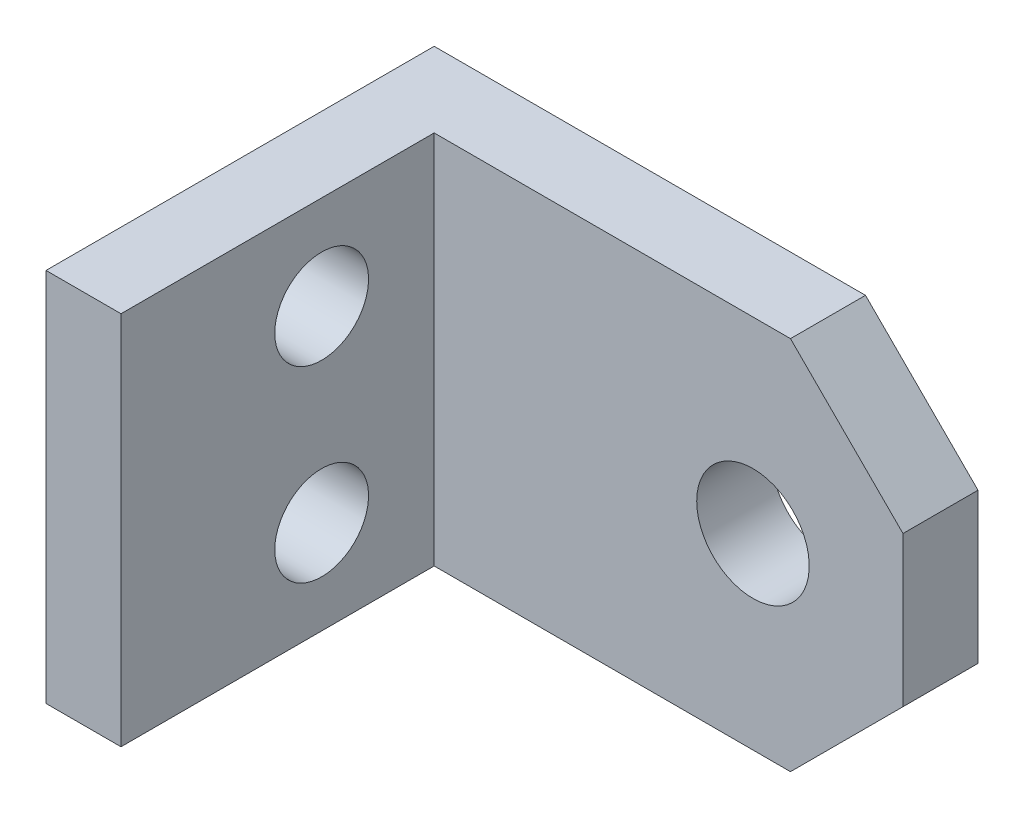
from build123d import *

# Parameters (mm, degrees)
SKETCH_1_W          = 20.7
SKETCH_1_H          = 20
EXTRUDE_1_DEPTH     = 4
SKETCH_2_W          = 4
SKETCH_2_H          = 20
EXTRUDE_2_DEPTH     = 25
SKETCH_3_R          = 2.5
CUT_EXTRUDE_1_DEPTH = 4
SKETCH_4_R          = 3
CUT_EXTRUDE_2_DEPTH = 4
CHAMFER_1_SIZE      = 6


with BuildPart() as part:
    # Эскиз1 → Бобышка-Вытянуть1 (new body)
    with BuildSketch(Plane(origin=(0, 0, 0), x_dir=(0, 0, -1), z_dir=(1, 0, 0))):
        with Locations((10.35, 10)):
            Rectangle(SKETCH_1_W, SKETCH_1_H)
    extrude(amount=EXTRUDE_1_DEPTH)

    # Эскиз2 → Бобышка-Вытянуть2 (add)
    with BuildSketch(Plane(origin=(4, 0, 0), x_dir=(0, 0, -1), z_dir=(1, 0, 0))):
        with Locations((18.7, 10)):
            Rectangle(SKETCH_2_W, SKETCH_2_H)
    extrude(amount=EXTRUDE_2_DEPTH)

    # Эскиз3 → Вырез-Вытянуть1 (cut)
    with BuildSketch(Plane.ZY):
        with Locations((-10.7, 15)):
            Circle(SKETCH_3_R)
        with Locations((-10.7, 5)):
            Circle(SKETCH_3_R)
    extrude(amount=-CUT_EXTRUDE_1_DEPTH, mode=Mode.SUBTRACT)

    # Эскиз4 → Вырез-Вытянуть2 (cut)
    with BuildSketch(Plane(origin=(0, 0, -20.7), x_dir=(-1, 0, 0), z_dir=(0, 0, -1))):
        with Locations((-21, 10)):
            Circle(SKETCH_4_R)
    extrude(amount=-CUT_EXTRUDE_2_DEPTH, mode=Mode.SUBTRACT)

    # Фаска1
    chamfer_1_edges = [part.edges().sort_by_distance(p)[0] for p in [
        (29, 0, -18.7),
        (29, 20, -18.7),
    ]]
    chamfer(chamfer_1_edges, length=CHAMFER_1_SIZE)


solid = part.part
